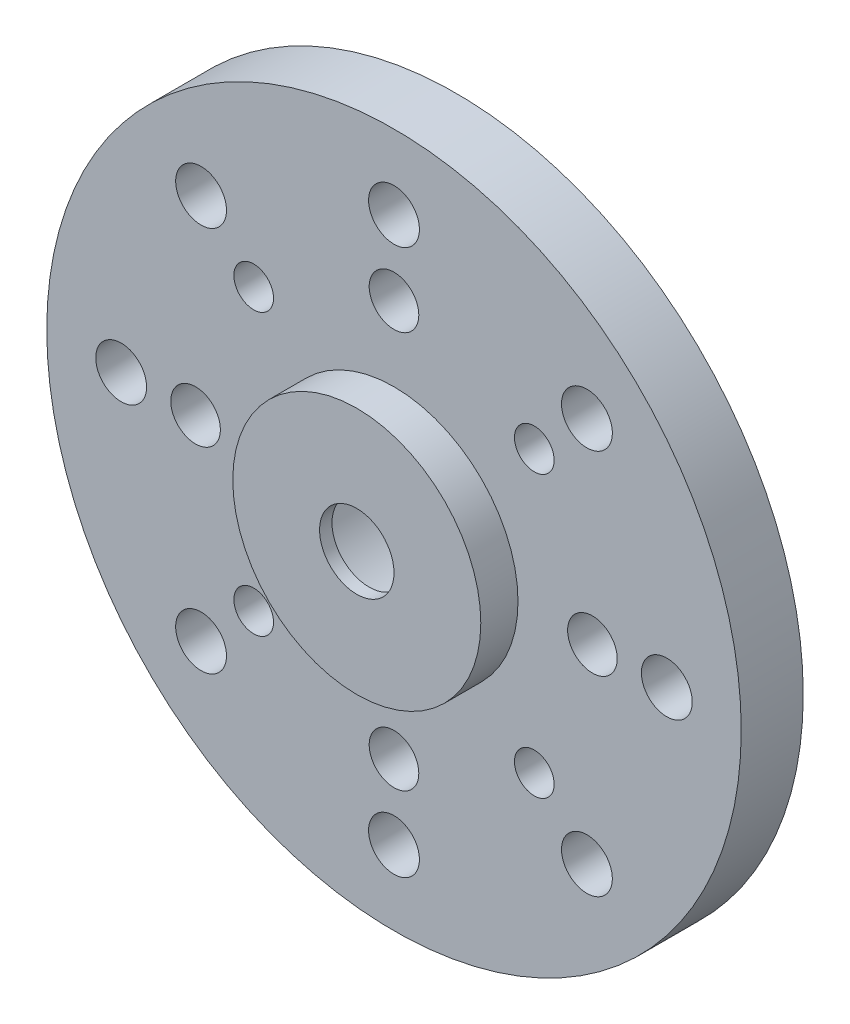
from build123d import *

# Parameters (mm, degrees)
F_3_0_3_DIAMETER_HOLE1_D = 3
M2_5_TAPPED_HOLE1_D      = 2.05
CIRPATTERN1_COUNT        = 8
F_2_0_2_DIAMETER_HOLE1_D = 2
M2_TAPPED_HOLE1_D        = 1.6
CIRPATTERN2_COUNT        = 4
SKETCH14_R               = 3.5
CUT_EXTRUDE1_DEPTH       = 4


with BuildPart() as part:
    # Sketch1 → Revolve1 (revolve)
    with BuildSketch(Plane.XZ, mode=Mode.PRIVATE) as revolve1_sk:
        Polygon((2.75, 25), (0, 25), (0, 24.516404416), (0, 20.5), (5.5, 20.5), (5.5, 21), (14, 21), (14, 23.5), (5, 23.5), (5, 25), align=None)
    revolve(revolve1_sk.sketch.rotate(Axis((0, 0, 24.516404416), (0, 0, -1)), 180), axis=Axis((0, 0, 24.516404416), (0, 0, -1)))

    # Ø3.0 (3) Diameter Hole1 (through all)
    with Locations(Plane.XY.offset(25)):
        with Locations((0, 0)):
            Hole(F_3_0_3_DIAMETER_HOLE1_D / 2)

    # M2.5 Tapped Hole1 (through all)
    with Locations(Plane.XY.offset(23.5)):
        with Locations((0, 11)):
            m2_5_tapped_hole1 = Hole(M2_5_TAPPED_HOLE1_D / 2)

    # CirPattern1: M2.5 Tapped Hole1 ×8 about axis
    cirpattern1_axis = Axis((0, 0, 0), (0, 0, 1))
    for i in range(1, CIRPATTERN1_COUNT):
        add(m2_5_tapped_hole1.rotate(cirpattern1_axis, i * 360 / CIRPATTERN1_COUNT), mode=Mode.SUBTRACT)

    # Ø2.0 (2) Diameter Hole1 (through all)
    with Locations(Plane.XY.offset(25)):
        with Locations((0, 8), (8, 0), (0, -8), (-8, 0)):
            Hole(F_2_0_2_DIAMETER_HOLE1_D / 2)

    # M2 Tapped Hole1 (through all)
    with Locations(Plane.XY.offset(23.5)):
        with Locations((5.656854249, 5.656854249)):
            m2_tapped_hole1 = Hole(M2_TAPPED_HOLE1_D / 2)

    # CirPattern2: M2 Tapped Hole1 ×4 about axis
    cirpattern2_axis = Axis((0, 0, 0), (0, 0, 1))
    for i in range(1, CIRPATTERN2_COUNT):
        add(m2_tapped_hole1.rotate(cirpattern2_axis, i * 360 / CIRPATTERN2_COUNT), mode=Mode.SUBTRACT)

    # Sketch14 → Cut-Extrude1 (cut)
    with BuildSketch(Plane(origin=(0, 0, 20.5), x_dir=(-1, 0, 0), z_dir=(0, 0, -1))):
        Circle(SKETCH14_R)
    extrude(amount=-CUT_EXTRUDE1_DEPTH, mode=Mode.SUBTRACT)


solid = part.part
